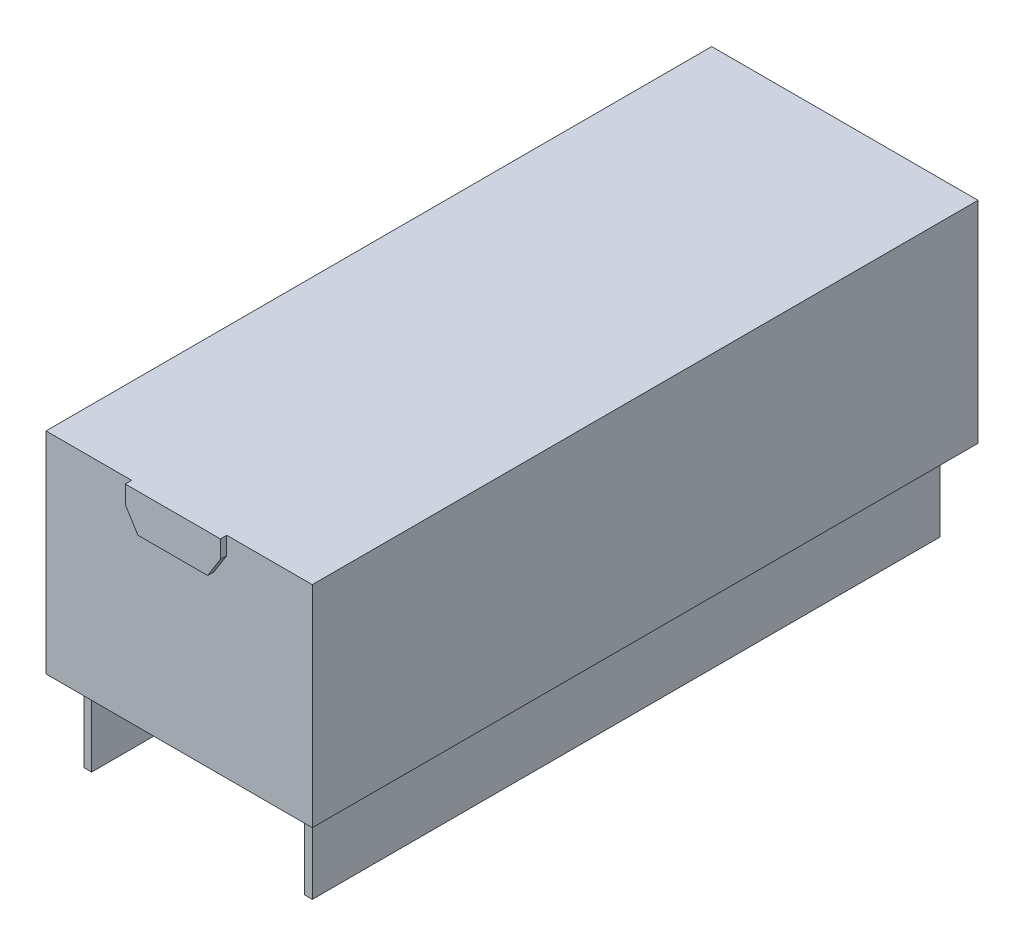
from build123d import *

# Parameters (mm, degrees)
SKETCH1_W           = 21
SKETCH1_H           = 52.5
BOSS_EXTRUDE1_DEPTH = 16.6
BOSS_EXTRUDE2_DEPTH = 0.5
SKETCH3_W           = 0.6
SKETCH3_H           = 49.5
BOSS_EXTRUDE3_DEPTH = 6.4


with BuildPart() as part:
    # Sketch1 → Boss-Extrude1 (new body)
    with BuildSketch(Plane(origin=(0, 0, 0), x_dir=(1, 0, 0), z_dir=(0, 1, 0))):
        Rectangle(SKETCH1_W, SKETCH1_H)
    extrude(amount=BOSS_EXTRUDE1_DEPTH)

    # Sketch2 → Boss-Extrude2 (add)
    with BuildSketch(Plane.XY.offset(26.25)):
        Polygon((-3.75, 16.6), (-3.75, 15.2), (-2.75, 13.6), (2.75, 13.6), (3.75, 15.2), (3.75, 16.6), align=None)
    extrude(amount=BOSS_EXTRUDE2_DEPTH)

    # Sketch3 → Boss-Extrude3 (add)
    with BuildSketch(Plane.XZ):
        with Locations((-8.7, 0)):
            Rectangle(SKETCH3_W, SKETCH3_H)
        with Locations((8.7, 0)):
            Rectangle(SKETCH3_W, SKETCH3_H)
    extrude(amount=BOSS_EXTRUDE3_DEPTH)


solid = part.part
